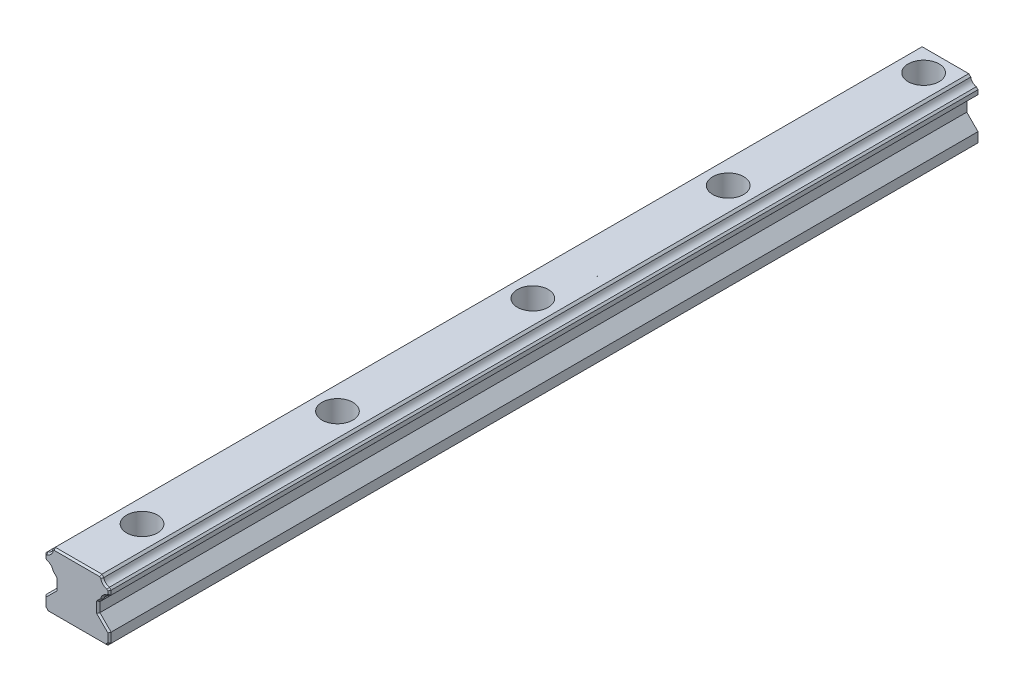
from build123d import *

# Parameters (mm, degrees)
BOSS_EXTRUDE1_DEPTH      = 140
BOSS_EXTRUDE1_DEPTH_BACK = 140
LPATTERN2_COUNT          = 5
LPATTERN2_PITCH          = 60
CHAMFER1_SIZE            = 0.5
CUT_EXTRUDE1_DEPTH       = 142.50618361
CUT_EXTRUDE1_DEPTH_BACK  = 142.50618361


with BuildPart() as part:
    # Sketch3 → Boss-Extrude1 (new, two sides: drawn at the far end of the back side and taken through both)
    with BuildSketch(Plane.XY.offset(-BOSS_EXTRUDE1_DEPTH_BACK)):
        with BuildLine():
            Line((3, 9), (-3, 9))
            Line((-3, 9), (-7.160036564, 9))
            Line((-7.160036564, 9), (-7.767930373, 8.392105714))
            ThreePointArc((-7.767930373, 8.392105714), (-8.344874488, 7.264307267), (-9.472673258, 6.687363783))
            Line((-9.472673258, 6.687363783), (-10, 6.160037041))
            Line((-10, 6.160037041), (-10, 4.82918644))
            Line((-10, 4.82918644), (-9.472673258, 4.314376637))
            ThreePointArc((-9.472673258, 4.314376637), (-8.341068744, 3.731631743), (-7.767930373, 2.595131504))
            Line((-7.767930373, 2.595131504), (-6.550048828, 1.379235268))
            Line((-6.550048828, 1.379235268), (-6.550048828, -1.550048828))
            Line((-6.550048828, -1.550048828), (-10, -4.999922752))
            Line((-10, -4.999922752), (-10, -8))
            Line((-10, -8), (-9, -9))
            Line((-9, -9), (0, -9))
            Line((0, -9), (9, -9))
            Line((9, -9), (10, -8))
            Line((10, -8), (10, -4.999922752))
            Line((10, -4.999922752), (6.550048828, -1.550048828))
            Line((6.550048828, -1.550048828), (6.550048828, 1.379235268))
            Line((6.550048828, 1.379235268), (7.767930373, 2.595131504))
            ThreePointArc((7.767930373, 2.595131504), (8.341068744, 3.731631743), (9.472673258, 4.314376637))
            Line((9.472673258, 4.314376637), (10, 4.82918644))
            Line((10, 4.82918644), (10, 6.160037041))
            Line((10, 6.160037041), (9.472673258, 6.687363783))
            ThreePointArc((9.472673258, 6.687363783), (8.344874488, 7.264307267), (7.767930373, 8.392105714))
            Line((7.767930373, 8.392105714), (7.160036564, 9))
            Line((7.160036564, 9), (3, 9))
        make_face()
    extrude(amount=BOSS_EXTRUDE1_DEPTH + BOSS_EXTRUDE1_DEPTH_BACK)

    # Sketch4 → Cut-Revolve1 (revolve, cut)
    with BuildSketch(Plane(origin=(0, 0, 0), x_dir=(0, 0, -1), z_dir=(1, 0, 0)), mode=Mode.PRIVATE) as cut_revolve1_sk:
        Polygon((-115.25, 9), (-120, 9), (-120, -9), (-117, -9), (-117, 0.5), (-115.25, 0.5), align=None)
    cut_revolve1 = revolve(cut_revolve1_sk.sketch.rotate(Axis((0, 9, 120), (0, -1, 0)), 180), axis=Axis((0, 9, 120), (0, -1, 0)), mode=Mode.SUBTRACT)

    # LPattern2: Cut-Revolve1 ×5
    with Locations(*[(0, 0, -i * LPATTERN2_PITCH) for i in range(1, LPATTERN2_COUNT)]):
        add(cut_revolve1, mode=Mode.SUBTRACT)

    # Chamfer1
    chamfer1_edges = [part.edges().sort_by_distance(p)[0] for p in [
        (-6.550048828, -0.08540678, 140),
        (-8.275024414, -3.27498579, 140),
        (-10, -6.499961376, 140),
        (-9.5, -8.5, 140),
        (0, -9, 140),
        (9.5, -8.5, 140),
        (10, -6.499961376, 140),
        (8.275024414, -3.27498579, 140),
        (6.550048828, -0.08540678, 140),
        (-8.341068744, 3.731631743, 140),
        (7.158989601, 1.987183386, 140),
        (8.341068744, 3.731631743, 140),
        (9.736336629, 4.571781538, 140),
        (-9.736336629, 4.571781538, -140),
        (-10, 5.49461174, -140),
        (10, 5.49461174, 140),
        (-9.736336629, 6.423700412, -140),
        (-7.463983469, 8.696052857, -140),
        (0, 9, -140),
        (7.463983469, 8.696052857, -140),
        (9.736336629, 6.423700412, -140),
        (10, 5.49461174, -140),
        (9.736336629, 6.423700412, 140),
        (9.736336629, 4.571781538, -140),
        (7.158989601, 1.987183386, -140),
        (6.550048828, -0.08540678, -140),
        (8.275024414, -3.27498579, -140),
        (10, -6.499961376, -140),
        (9.5, -8.5, -140),
        (0, -9, -140),
        (8.344874488, 7.264307267, 140),
        (-9.5, -8.5, -140),
        (-10, -6.499961376, -140),
        (-8.275024414, -3.27498579, -140),
        (-6.550048828, -0.08540678, -140),
        (-7.158989601, 1.987183386, -140),
        (-8.341068744, 3.731631743, -140),
        (-8.344874488, 7.264307267, -140),
        (8.344874488, 7.264307267, -140),
        (8.341068744, 3.731631743, -140),
        (7.463983469, 8.696052857, 140),
        (0, 9, 140),
        (-7.463983469, 8.696052857, 140),
        (-8.344874488, 7.264307267, 140),
        (-7.158989601, 1.987183386, 140),
        (-9.736336629, 6.423700412, 140),
        (-10, 5.49461174, 140),
        (-9.736336629, 4.571781538, 140),
    ]]
    chamfer(chamfer1_edges, length=CHAMFER1_SIZE)

    # Sketch7 → Cut-Extrude1 (cut, two sides: drawn at the far end of the back side and taken through both)
    with BuildSketch(Plane.XZ.offset(9).offset(-CUT_EXTRUDE1_DEPTH_BACK)):
        Polygon((563.970585521, -126.7), (15.689992686, -126.7), (-26.160878802, -126.7), (-574.441471637, -126.7), (-574.441471637, -1223.26118567), (563.970585521, -1223.26118567), align=None)
    extrude(amount=CUT_EXTRUDE1_DEPTH + CUT_EXTRUDE1_DEPTH_BACK, mode=Mode.SUBTRACT)


solid = part.part
